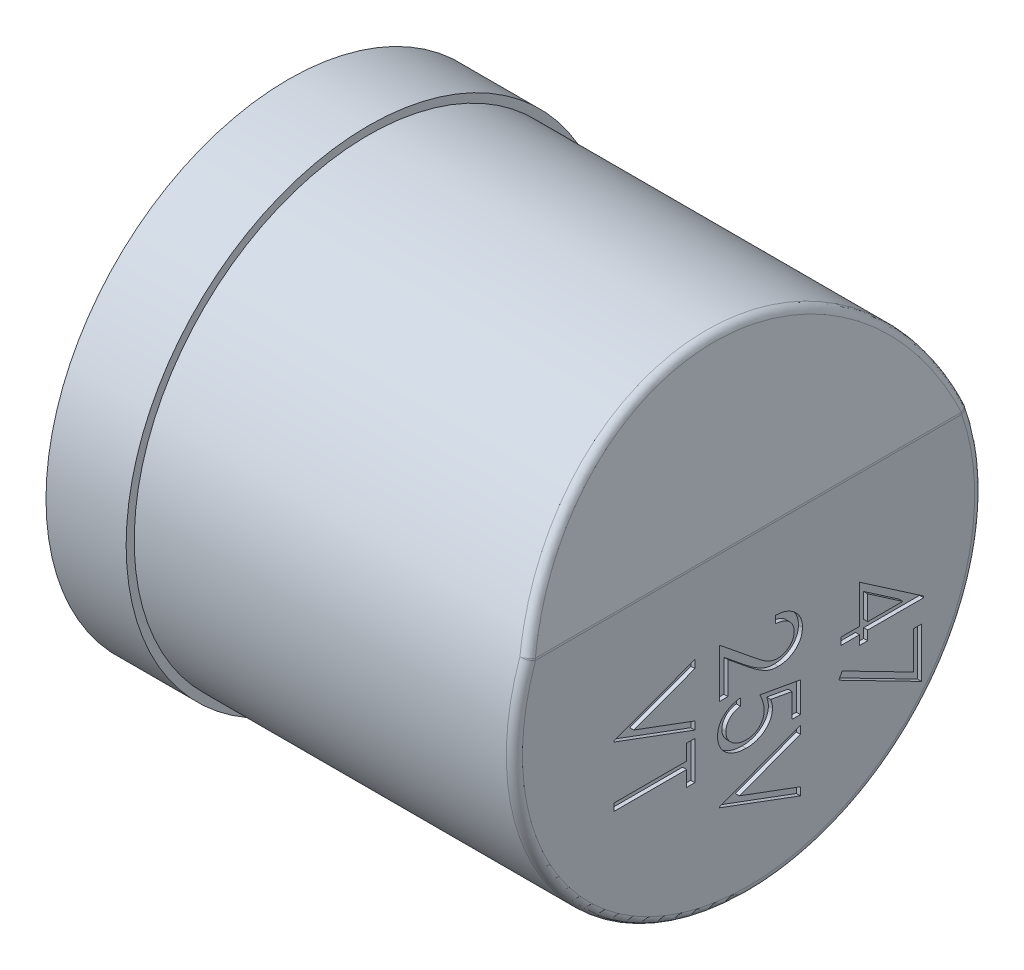
from build123d import *

# Parameters (mm, degrees)
ENL_V_MAT_EXTRU_1_DEPTH = 5
CONG_1_R                = 0.1
ENL_V_MAT_EXTRU_2_DEPTH = 0.05


with BuildPart() as part:
    # Esquisse1 → Révolution1 (revolve)
    with BuildSketch(Plane.XY, mode=Mode.PRIVATE) as r_volution1_sk:
        Polygon((0, 0), (0, 3), (0.992307692, 3), (0.992307692, 2.9), (5.7, 2.9), (5.7, 0), align=None)
    revolve(r_volution1_sk.sketch.rotate(Axis((5.7, 0, 0), (-1, 0, 0)), 90), axis=Axis((5.7, 0, 0), (-1, 0, 0)))

    # Esquisse2 → Enlèv. mat.-Extru.1 (cut, symmetric)
    with BuildSketch(Plane.XY):
        Polygon((5.256942893, 2.9), (5.7, 0.949692229), (6.538321145, 1.14013609), (6.095264038, 3.09044386), align=None)
    extrude(amount=ENL_V_MAT_EXTRU_1_DEPTH, both=True, mode=Mode.SUBTRACT)

    # Congé1
    cong_1_edges = [part.edges().sort_by_distance(p)[0] for p in [
        (5.7, -2.859742688, 0.481530642),
        (5.7, 0.949692229, 0),
        (5.380558658, 2.355851666, -1.691142492),
    ]]
    fillet(cong_1_edges, radius=CONG_1_R)

    # Esquisse3 → Enlèv. mat.-Extru.2 (cut)
    # profile 1 of 7: a face of its own
    with BuildSketch(Plane(origin=(5.7, 0, 0), x_dir=(0, 0, -1), z_dir=(1, 0, 0))):
        Polygon((2.167990455, -0.774087544), (2.167990455, -0.79231671), (1.475682763, -0.79231671), (1.475682763, -0.907701326), (1.37311866, -0.907701326), (1.37311866, -0.79231671), (1.142349429, -0.79231671), (1.142349429, -0.702573121), (1.37311866, -0.702573121), (1.37311866, -0.228214146), align=None)
        Polygon((1.475682763, -0.702573121), (1.909977634, -0.702573121), (1.475682763, -0.404496197), align=None, mode=Mode.SUBTRACT)
    # profile 2 of 7: a face of its own
    with BuildSketch(Plane(origin=(5.7, 0, 0), x_dir=(0, 0, -1), z_dir=(1, 0, 0))):
        Polygon((2.142349429, -1.061547479), (2.142349429, -1.676932095), (1.116708404, -1.151291069), (1.159376673, -1.073767031), (2.039785327, -1.525089146), (2.039785327, -1.061547479), align=None)
    # profile 3 of 7: a face of its own
    with BuildSketch(Plane(origin=(5.7, 0, 0), x_dir=(0, 0, -1), z_dir=(1, 0, 0))):
        with BuildLine():
            Line((0.334006211, -0.153846154), (0.334006211, -0.064102564))
            add(Edge.make_bspline(
                [(0.334006211, -0.064102564), (0.34590656, -0.064655531), (0.369254121, -0.065740409), (0.403346827, -0.07041964), (0.435863275, -0.077401226), (0.466754935, -0.086940958), (0.495979558, -0.099334088), (0.52367228, -0.113886919), (0.549728356, -0.131036371), (0.573771657, -0.150611835), (0.595718525, -0.171847816), (0.614985454, -0.19458331), (0.63095831, -0.218760196), (0.644458816, -0.243946575), (0.654567689, -0.270519716), (0.662108327, -0.298202428), (0.666600709, -0.327176241), (0.667090785, -0.346939478), (0.667339544, -0.356971154)],
                knots=[0, 0, 0, 0, 1.157348951, 2.270628868, 3.339854951, 4.38667075, 5.407537659, 6.420681518, 7.423232439, 8.433712426, 9.429582902, 10.387626108, 11.323566714, 12.240895944, 13.159234641, 14.08016076, 15.025503541, 16, 16, 16, 16], degree=3))
            add(Edge.make_bspline(
                [(0.667339544, -0.356971154), (0.667083297, -0.366868943), (0.666582215, -0.386223679), (0.662271034, -0.414506606), (0.655213787, -0.441270321), (0.645645945, -0.46677507), (0.632885394, -0.49073522), (0.617321952, -0.513217792), (0.59925446, -0.534506372), (0.578173478, -0.553615019), (0.555567071, -0.571159529), (0.531631345, -0.586453307), (0.506695821, -0.599352022), (0.480705644, -0.609775031), (0.453761414, -0.617989309), (0.425850554, -0.624101795), (0.396856401, -0.62746742), (0.377216797, -0.627956939), (0.367259416, -0.628205128)],
                knots=[0, 0, 0, 0, 1.051662044, 2.056483628, 3.032643507, 3.989674936, 4.94538941, 5.910102067, 6.891691746, 7.906317673, 8.928512402, 9.930723403, 10.921177931, 11.908397211, 12.903039297, 13.91236324, 14.941557282, 16, 16, 16, 16], degree=3))
            add(Edge.make_bspline(
                [(0.367259416, -0.628205128), (0.353210524, -0.627792492), (0.325421601, -0.626976293), (0.284495061, -0.620133617), (0.244929422, -0.609073583), (0.212845972, -0.596057016), (0.186915735, -0.582874836), (0.165807731, -0.57088714), (0.14311949, -0.556707176), (0.118629941, -0.540675715), (0.092506698, -0.522513114), (0.064839922, -0.502119387), (0.035331085, -0.479976418), (0.015391084, -0.464125922), (0.005079929, -0.455929487)],
                knots=[0, 0, 0, 0, 1.233482511, 2.439847245, 3.633928361, 4.836450955, 5.473897344, 6.188356043, 6.968050959, 7.823797873, 8.759406765, 9.762507455, 10.842972314, 12, 12, 12, 12], degree=3))
            Line((0.005079929, -0.455929487), (-0.255737379, -0.243990385))
            Line((-0.255737379, -0.243990385), (-0.255737379, -0.641025641))
            Line((-0.255737379, -0.641025641), (-0.358301481, -0.641025641))
            Line((-0.358301481, -0.641025641), (-0.358301481, -0.038461538))
            Line((-0.358301481, -0.038461538), (0.055560698, -0.374599359))
            add(Edge.make_bspline(
                [(0.055560698, -0.374599359), (0.065423386, -0.382769752), (0.084392855, -0.398484333), (0.112031083, -0.420734149), (0.137687495, -0.440748752), (0.161231874, -0.45874356), (0.183167203, -0.473982746), (0.20268685, -0.487652274), (0.220547724, -0.498622381), (0.241452341, -0.510415246), (0.266895409, -0.521750512), (0.297860929, -0.53147002), (0.32971937, -0.537235077), (0.351210818, -0.538050327), (0.362051083, -0.538461538)],
                knots=[0, 0, 0, 0, 1.297618079, 2.495782571, 3.594697613, 4.594628131, 5.497499245, 6.300647139, 7.008465005, 7.620238698, 8.731681699, 9.822989966, 10.90191829, 12, 12, 12, 12], degree=3))
            add(Edge.make_bspline(
                [(0.362051083, -0.538461538), (0.368871123, -0.53833107), (0.382296074, -0.538074247), (0.401998928, -0.535344841), (0.420963394, -0.531134947), (0.439310714, -0.525339345), (0.456881293, -0.517733441), (0.473726833, -0.508412187), (0.489731835, -0.497296165), (0.505032983, -0.484867286), (0.518971259, -0.47110744), (0.531314148, -0.45650483), (0.541516432, -0.440964779), (0.55009496, -0.424779654), (0.556704715, -0.407774596), (0.561264429, -0.390011865), (0.56419854, -0.371557822), (0.564580395, -0.358985736), (0.564775442, -0.352564103)],
                knots=[0, 0, 0, 0, 1.06989504, 2.106041779, 3.115552866, 4.11659498, 5.121251965, 6.115853611, 7.133385419, 8.176137438, 9.206329872, 10.203413544, 11.171427972, 12.118447235, 13.074126855, 14.027447124, 14.992449553, 16, 16, 16, 16], degree=3))
            add(Edge.make_bspline(
                [(0.564775442, -0.352564103), (0.564570337, -0.345877737), (0.564166497, -0.332712655), (0.561348101, -0.313353604), (0.556486576, -0.294844953), (0.549885836, -0.277170957), (0.541460483, -0.260370753), (0.530822737, -0.244616154), (0.518447614, -0.229617034), (0.504190825, -0.215621712), (0.48833759, -0.2027455), (0.470804224, -0.191296336), (0.451718107, -0.18132975), (0.431189643, -0.17263511), (0.409052555, -0.165622224), (0.385350669, -0.160412598), (0.360242893, -0.155991265), (0.342904525, -0.15457368), (0.334006211, -0.153846154)],
                knots=[0, 0, 0, 0, 0.947602988, 1.86577741, 2.76562394, 3.655108361, 4.53548312, 5.422698895, 6.343649397, 7.287274027, 8.249509779, 9.233878305, 10.249904016, 11.297528036, 12.390018965, 13.535657216, 14.735261788, 16, 16, 16, 16], degree=3))
        make_face()
    # profile 4 of 7: a face of its own
    with BuildSketch(Plane(origin=(5.7, 0, 0), x_dir=(0, 0, -1), z_dir=(1, 0, 0))):
        with BuildLine():
            Line((0.641698519, -1.282051282), (0.539134416, -1.282051282))
            Line((0.539134416, -1.282051282), (0.539134416, -0.983373397))
            Line((0.539134416, -0.983373397), (0.274511019, -0.935897436))
            add(Edge.make_bspline(
                [(0.274511019, -0.935897436), (0.277724806, -0.945000586), (0.283921251, -0.962552204), (0.29059109, -0.988666659), (0.294558619, -1.013433646), (0.295223584, -1.029501171), (0.295544672, -1.037259615)],
                knots=[0, 0, 0, 0, 1.113143318, 2.146231409, 3.104880253, 4, 4, 4, 4], degree=3))
            add(Edge.make_bspline(
                [(0.295544672, -1.037259615), (0.295304777, -1.04689319), (0.294833996, -1.065798513), (0.290256831, -1.093407124), (0.283003774, -1.119731413), (0.272988666, -1.144825229), (0.260108634, -1.16869234), (0.244059009, -1.191010687), (0.225298138, -1.212185009), (0.203812807, -1.231858726), (0.179995683, -1.249488924), (0.1547143, -1.265411144), (0.127484273, -1.278222708), (0.098922643, -1.289307041), (0.0685105, -1.297318476), (0.036593205, -1.303374944), (0.003027955, -1.307033442), (-0.019884313, -1.307469661), (-0.031578725, -1.307692308)],
                knots=[0, 0, 0, 0, 0.973469236, 1.910376104, 2.821201604, 3.730248367, 4.636658205, 5.556598413, 6.503693427, 7.492958471, 8.496340735, 9.496947385, 10.508655863, 11.53446159, 12.590964418, 13.68351193, 14.817665467, 16, 16, 16, 16], degree=3))
            add(Edge.make_bspline(
                [(-0.031578725, -1.307692308), (-0.047764048, -1.30716874), (-0.079639347, -1.306137627), (-0.126411659, -1.298671801), (-0.171024826, -1.285845051), (-0.206463639, -1.27141719), (-0.233257222, -1.257514112), (-0.252146602, -1.246093977), (-0.269763439, -1.23364266), (-0.286242195, -1.220416358), (-0.301501789, -1.206361866), (-0.315622404, -1.19149169), (-0.328496713, -1.175624934), (-0.339989655, -1.158790318), (-0.35059897, -1.141414045), (-0.359268775, -1.123045479), (-0.367028864, -1.104182136), (-0.373135855, -1.084589696), (-0.378051595, -1.064392444), (-0.381309093, -1.043547772), (-0.383728328, -1.022024827), (-0.383870361, -1.007419037), (-0.383942507, -1)],
                knots=[0, 0, 0, 0, 1.854118986, 3.65149321, 5.409637815, 7.162831605, 8.025148215, 8.866194382, 9.689764825, 10.495080939, 11.285578968, 12.064891195, 12.842737453, 13.623700291, 14.39913485, 15.172453004, 15.948151709, 16.734529536, 17.521316634, 18.32754076, 19.150471316, 20, 20, 20, 20], degree=3))
            add(Edge.make_bspline(
                [(-0.383942507, -1), (-0.383737633, -0.991237123), (-0.383332139, -0.973893389), (-0.379336331, -0.948554006), (-0.373391862, -0.924138674), (-0.364734436, -0.900907759), (-0.353584274, -0.878615315), (-0.340002417, -0.8574723), (-0.323898744, -0.837398831), (-0.305639491, -0.818489205), (-0.285135647, -0.801233108), (-0.26343468, -0.785240018), (-0.239861552, -0.771657146), (-0.21514936, -0.75958026), (-0.188810192, -0.749620032), (-0.16124501, -0.741068028), (-0.132032011, -0.73498251), (-0.112058379, -0.732190463), (-0.101891225, -0.730769231)],
                knots=[0, 0, 0, 0, 0.979908355, 1.939462404, 2.863745117, 3.788178844, 4.707160424, 5.648206106, 6.594635828, 7.582828443, 8.584601627, 9.590518696, 10.595269421, 11.624615585, 12.665398082, 13.743287689, 14.851268468, 16, 16, 16, 16], degree=3))
            Line((-0.101891225, -0.730769231), (-0.101891225, -0.820512821))
            add(Edge.make_bspline(
                [(-0.101891225, -0.820512821), (-0.111418899, -0.822327675), (-0.129668025, -0.825803814), (-0.155283769, -0.833814405), (-0.178359773, -0.843003697), (-0.198618281, -0.854595093), (-0.21655094, -0.868025104), (-0.232544092, -0.883445852), (-0.246760145, -0.900850863), (-0.258852037, -0.920080205), (-0.269013388, -0.940311133), (-0.275911132, -0.961607076), (-0.280640274, -0.983299127), (-0.281132358, -0.99803871), (-0.281378405, -1.005408654)],
                knots=[0, 0, 0, 0, 1.238019243, 2.371278635, 3.42311985, 4.404977487, 5.343294643, 6.278388067, 7.236275588, 8.206503492, 9.175493167, 10.119608425, 11.059784865, 12, 12, 12, 12], degree=3))
            add(Edge.make_bspline(
                [(-0.281378405, -1.005408654), (-0.281143642, -1.012568652), (-0.280680195, -1.026703274), (-0.277097987, -1.04751043), (-0.271654281, -1.067627866), (-0.263342096, -1.086752108), (-0.253452255, -1.105443577), (-0.240603329, -1.122935773), (-0.225944591, -1.139976945), (-0.208988103, -1.155751331), (-0.190524151, -1.170379099), (-0.17052763, -1.183014602), (-0.149501646, -1.193865913), (-0.127305503, -1.202739458), (-0.10402027, -1.209542288), (-0.079605139, -1.214274869), (-0.054096144, -1.217417726), (-0.036663172, -1.21776938), (-0.027772635, -1.217948718)],
                knots=[0, 0, 0, 0, 0.933535734, 1.842902018, 2.747499525, 3.645403545, 4.557519306, 5.500275769, 6.469699065, 7.486494768, 8.516377946, 9.538569803, 10.567089019, 11.599106673, 12.652087052, 13.726645312, 14.840625439, 16, 16, 16, 16], degree=3))
            add(Edge.make_bspline(
                [(-0.027772635, -1.217948718), (-0.019749327, -1.217841711), (-0.004050878, -1.217632341), (0.018835797, -1.21462355), (0.040597836, -1.210373011), (0.061122498, -1.20401275), (0.080715617, -1.196350785), (0.098926773, -1.186383479), (0.116115381, -1.174962694), (0.131938444, -1.161699214), (0.146229635, -1.147002784), (0.158921228, -1.131070242), (0.169159742, -1.113657679), (0.178294432, -1.095407136), (0.184677595, -1.075638011), (0.18960439, -1.054890562), (0.192377512, -1.032926936), (0.192776469, -1.017902579), (0.19298057, -1.010216346)],
                knots=[0, 0, 0, 0, 1.127153543, 2.205394974, 3.240091725, 4.240887386, 5.222343252, 6.19260069, 7.153365258, 8.119754666, 9.089012447, 10.031767014, 10.975222428, 11.924126675, 12.894883555, 13.887722234, 14.919390869, 16, 16, 16, 16], degree=3))
            add(Edge.make_bspline(
                [(0.19298057, -1.010216346), (0.192814449, -1.003532746), (0.192471256, -0.989724974), (0.189950505, -0.968573968), (0.185878956, -0.946378148), (0.18024561, -0.923176272), (0.17299962, -0.898914547), (0.164085102, -0.873618439), (0.153772629, -0.847241395), (0.145785302, -0.829559772), (0.141698519, -0.820512821)],
                knots=[0, 0, 0, 0, 0.810269167, 1.673950008, 2.579134618, 3.545268136, 4.567349434, 5.647883586, 6.7965197, 8, 8, 8, 8], degree=3))
            Line((0.141698519, -0.820512821), (0.641698519, -0.91025641))
            Line((0.641698519, -0.91025641), (0.641698519, -1.282051282))
        make_face()
    # profile 5 of 7: a face of its own
    with BuildSketch(Plane(origin=(5.7, 0, 0), x_dir=(0, 0, -1), z_dir=(1, 0, 0))):
        Polygon((0.641698519, -1.397435897), (0.641698519, -1.494791667), (-0.113910456, -1.775641026), (0.641698519, -2.056490385), (0.641698519, -2.153846154), (-0.358301481, -1.782051282), (-0.358301481, -1.769230769), align=None)
    # profile 6 of 7: a face of its own
    with BuildSketch(Plane(origin=(5.7, 0, 0), x_dir=(0, 0, -1), z_dir=(1, 0, 0))):
        Polygon((-0.665048061, -0.038461538), (-0.665048061, -0.135817308), (-1.420657035, -0.416666667), (-0.665048061, -0.697516026), (-0.665048061, -0.794871795), (-1.665048061, -0.423076923), (-1.665048061, -0.41025641), align=None)
    # profile 7 of 7: a face of its own
    with BuildSketch(Plane(origin=(5.7, 0, 0), x_dir=(0, 0, -1), z_dir=(1, 0, 0))):
        Polygon((-0.767612164, -0.884615385), (-0.665048061, -0.884615385), (-0.665048061, -1.358974359), (-0.767612164, -1.358974359), (-0.767612164, -1.166666667), (-1.665048061, -1.166666667), (-1.665048061, -1.076923077), (-0.767612164, -1.076923077), align=None)
    extrude(amount=-ENL_V_MAT_EXTRU_2_DEPTH, mode=Mode.SUBTRACT)


solid = part.part
